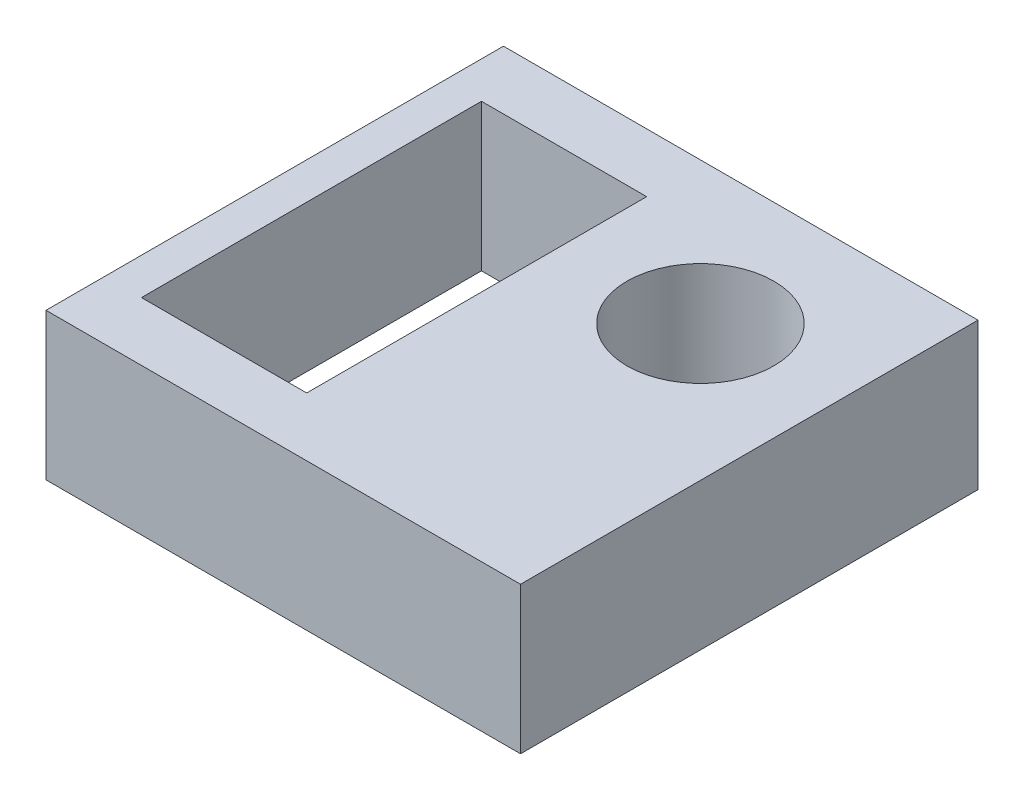
from build123d import *

# Parameters (mm, degrees)
SKETCH1_W           = 82.0674
SKETCH1_H           = 79.121
SKETCH1_R           = 12.7
SKETCH1_W_2         = 28.575
SKETCH1_H_2         = 58.801
BOSS_EXTRUDE1_DEPTH = 25.4


with BuildPart() as part:
    # Sketch1 → Boss-Extrude1 (new body)
    with BuildSketch(Plane(origin=(0, 0, 0), x_dir=(1, 0, 0), z_dir=(0, 1, 0))):
        with Locations((-41.0337, 39.5605)):
            Rectangle(SKETCH1_W, SKETCH1_H)
        with Locations(Location((-23.495, 54.61, 0), (0, 0, 270))):
            Circle(SKETCH1_R, mode=Mode.SUBTRACT)
        with Locations((-61.4299, 39.5605)):
            Rectangle(SKETCH1_W_2, SKETCH1_H_2, mode=Mode.SUBTRACT)
    extrude(amount=BOSS_EXTRUDE1_DEPTH)


solid = part.part
